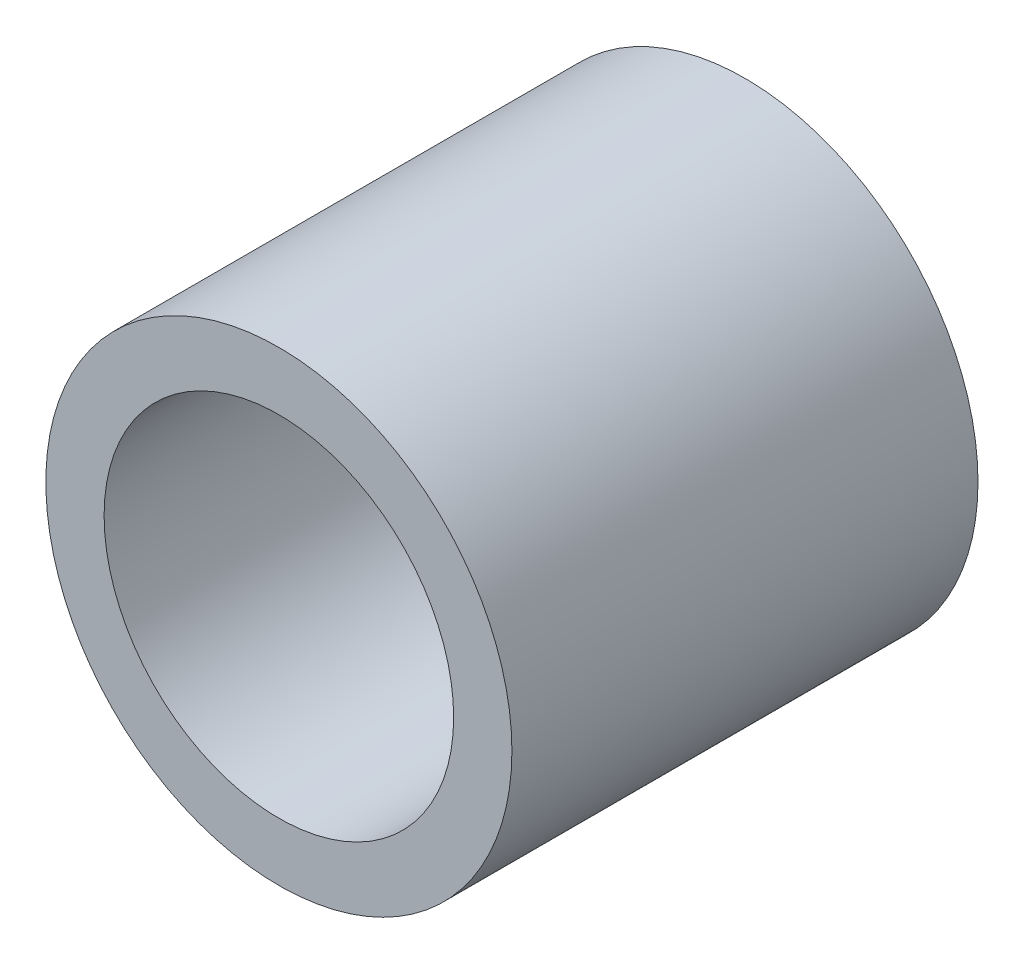
from build123d import *

# Parameters (mm, degrees)
SKETCH2_R           = 12.7
SKETCH2_R_2         = 9.525
BOSS_EXTRUDE1_DEPTH = 12.7


with BuildPart() as part:
    # Sketch2 → Boss-Extrude1 (new, symmetric)
    with BuildSketch(Plane.XY):
        Circle(SKETCH2_R)
        Circle(SKETCH2_R_2, mode=Mode.SUBTRACT)
    extrude(amount=BOSS_EXTRUDE1_DEPTH, both=True)


solid = part.part
